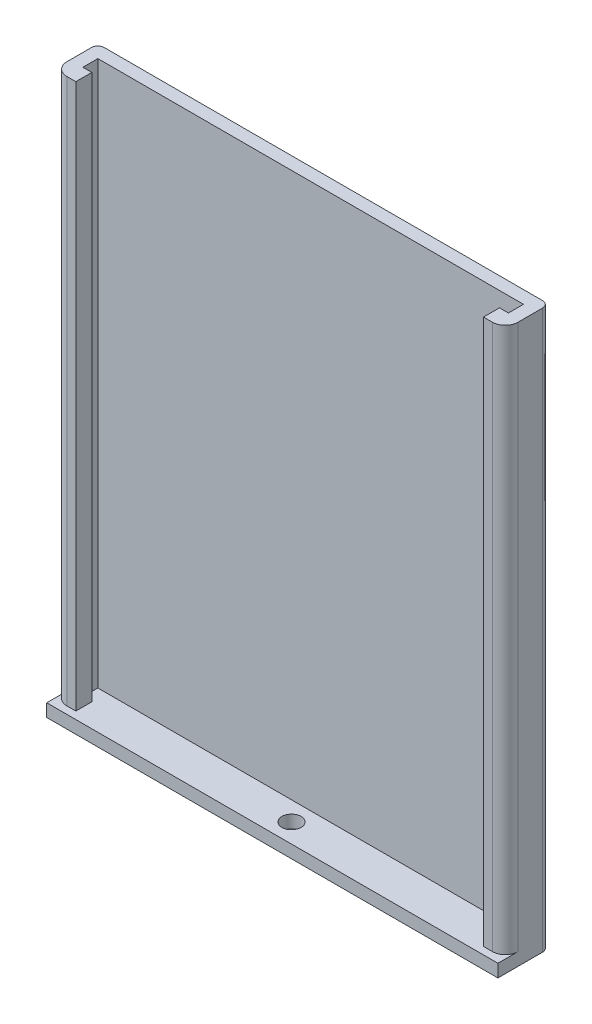
from build123d import *

# Parameters (mm, degrees)
IZIM1_W                     = 66.6
IZIM1_H                     = 83
Y_KSEKLIK_EKSTR_ZYON1_DEPTH = 2
Y_KSEKLIK_EKSTR_ZYON2_DEPTH = 83
Y_KSEKLIK_EKSTR_ZYON3_DEPTH = 2.3
Y_KSEKLIK_EKSTR_ZYON4_DEPTH = 2
IZIM6_R                     = 1.5
KES_EKSTR_ZYON2_DEPTH       = 4


with BuildPart() as part:
    # Çizim1 → Yükseklik-Ekstrüzyon1 (new body)
    with BuildSketch(Plane.XY):
        with Locations((33.3, 41.5)):
            Rectangle(IZIM1_W, IZIM1_H)
    extrude(amount=Y_KSEKLIK_EKSTR_ZYON1_DEPTH)

    # Çizim2 → Yükseklik-Ekstrüzyon2 (add)
    with BuildSketch(Plane(origin=(0, 83, 0), x_dir=(1, 0, 0), z_dir=(0, 1, 0))):
        with BuildLine():
            Line((0, 0), (-1, 0))
            ThreePointArc((-1, 0), (-1.707106781, -0.292893219), (-2, -1))
            Line((-2, -1), (-2, -4.85))
            ThreePointArc((-2, -4.85), (-1.414213562, -6.264213562), (0, -6.85))
            Line((0, -6.85), (1.4, -6.85))
            Line((1.4, -6.85), (1.4, -4.35))
            Line((1.4, -4.35), (0, -4.35))
            Line((0, -4.35), (0, 0))
        make_face()
        with BuildLine():
            Line((65.2, -4.35), (65.2, -6.85))
            Line((65.2, -6.85), (66.6, -6.85))
            ThreePointArc((66.6, -6.85), (68.014213562, -6.264213562), (68.6, -4.85))
            Line((68.6, -4.85), (68.6, -1))
            ThreePointArc((68.6, -1), (68.307106781, -0.292893219), (67.6, 0))
            Line((67.6, 0), (66.6, 0))
            Line((66.6, 0), (66.6, -4.35))
            Line((66.6, -4.35), (65.2, -4.35))
        make_face()
    extrude(amount=-Y_KSEKLIK_EKSTR_ZYON2_DEPTH)

    # Çizim4 → Yükseklik-Ekstrüzyon3 (add)
    with BuildSketch(Plane.XZ):
        with BuildLine():
            Line((-1, 0), (67.6, 0))
            ThreePointArc((67.6, 0), (68.307106781, 0.292893219), (68.6, 1))
            Line((68.6, 1), (68.6, 4.85))
            ThreePointArc((68.6, 4.85), (68.014213562, 6.264213562), (66.6, 6.85))
            Line((66.6, 6.85), (65.2, 6.85))
            Line((65.2, 6.85), (65.2, 4.35))
            Line((65.2, 4.35), (66.6, 4.35))
            Line((66.6, 4.35), (66.6, 2))
            Line((66.6, 2), (0, 2))
            Line((0, 2), (0, 4.35))
            Line((0, 4.35), (1.4, 4.35))
            Line((1.4, 4.35), (1.4, 6.85))
            Line((1.4, 6.85), (0, 6.85))
            ThreePointArc((0, 6.85), (-1.414213562, 6.264213562), (-2, 4.85))
            Line((-2, 4.85), (-2, 1))
            ThreePointArc((-2, 1), (-1.707106781, 0.292893219), (-1, 0))
        make_face()
    extrude(amount=Y_KSEKLIK_EKSTR_ZYON3_DEPTH)

    # Çizim5 → Yükseklik-Ekstrüzyon4 (add)
    with BuildSketch(Plane.XZ.offset(2.3)):
        with BuildLine():
            Line((67.6, 0), (-1, 0))
            ThreePointArc((-1, 0), (-1.707106781, 0.292893219), (-2, 1))
            Line((-2, 1), (-2, 8))
            Line((-2, 8), (68.6, 8))
            Line((68.6, 8), (68.6, 1))
            ThreePointArc((68.6, 1), (68.307106781, 0.292893219), (67.6, 0))
        make_face()
    extrude(amount=Y_KSEKLIK_EKSTR_ZYON4_DEPTH)

    # Çizim6 → Kes-Ekstrüzyon2 (cut)
    with BuildSketch(Plane.XZ.offset(4.3)):
        with Locations(Location((33.3, 5, 0), (0, 0, 270))):
            Circle(IZIM6_R)
    extrude(amount=-KES_EKSTR_ZYON2_DEPTH, mode=Mode.SUBTRACT)


solid = part.part
